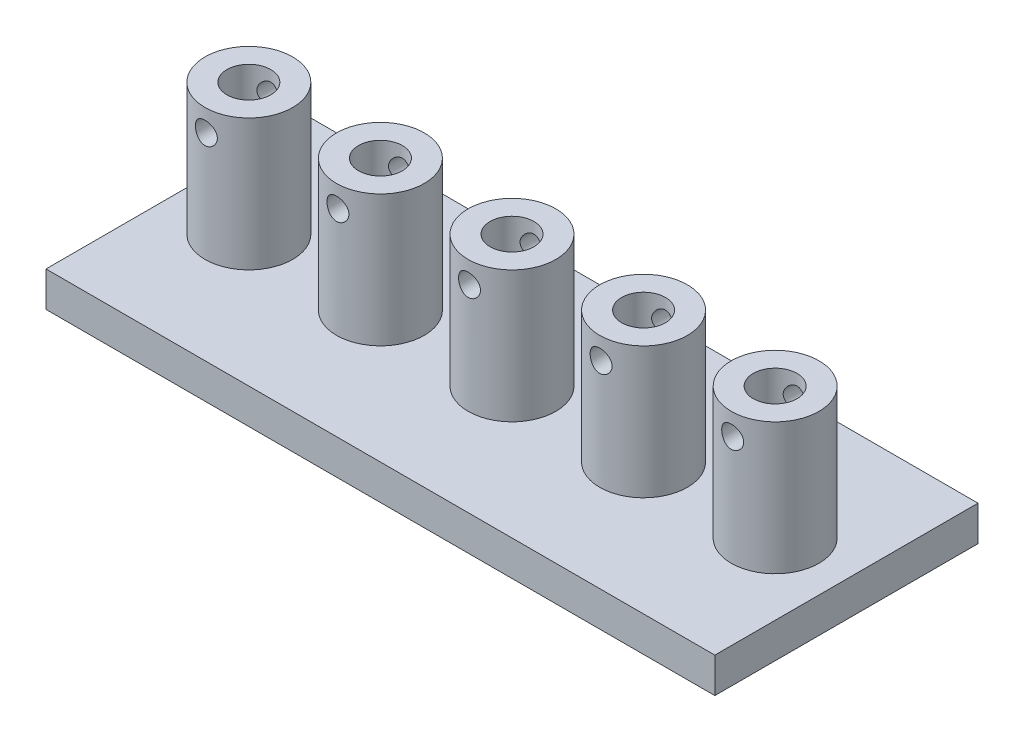
from build123d import *

# Parameters (mm, degrees)
SKETCH1_W               = 30.5
SKETCH1_H               = 12
BOSS_EXTRUDE1_DEPTH     = 1.6
SKETCH2_R               = 2
SKETCH2_R_2             = 1
BOSS_EXTRUDE2_DEPTH     = 6
CUT_EXTRUDE1_DEPTH      = 2
CUT_EXTRUDE1_DEPTH_BACK = 2
SKETCH3_R               = 0.5


with BuildPart() as part:
    # Sketch1 → Boss-Extrude1 (new body)
    with BuildSketch(Plane(origin=(0, 0, 0), x_dir=(1, 0, 0), z_dir=(0, 1, 0))):
        Rectangle(SKETCH1_W, SKETCH1_H)
    extrude(amount=BOSS_EXTRUDE1_DEPTH)

    # Sketch2 → Boss-Extrude2 (add)
    # profile 1 of 5: a face of its own
    with BuildSketch(Plane(origin=(0, 1.6, 0), x_dir=(1, 0, 0), z_dir=(0, 1, 0))):
        with Locations(Location((0, 0, 0), (0, 0, 270))):
            Circle(SKETCH2_R)
        with Locations(Location((0, 0, 0), (0, 0, 270))):
            Circle(SKETCH2_R_2, mode=Mode.SUBTRACT)
    # profile 2 of 5: a face of its own
    with BuildSketch(Plane(origin=(0, 1.6, 0), x_dir=(1, 0, 0), z_dir=(0, 1, 0))):
        with Locations(Location((6, 0, 0), (0, 0, 270))):
            Circle(SKETCH2_R)
        with Locations(Location((6, 0, 0), (0, 0, 270))):
            Circle(SKETCH2_R_2, mode=Mode.SUBTRACT)
    # profile 3 of 5: a face of its own
    with BuildSketch(Plane(origin=(0, 1.6, 0), x_dir=(1, 0, 0), z_dir=(0, 1, 0))):
        with Locations(Location((12, 0, 0), (0, 0, 270))):
            Circle(SKETCH2_R)
        with Locations(Location((12, 0, 0), (0, 0, 270))):
            Circle(SKETCH2_R_2, mode=Mode.SUBTRACT)
    # profile 4 of 5: a face of its own
    with BuildSketch(Plane(origin=(0, 1.6, 0), x_dir=(1, 0, 0), z_dir=(0, 1, 0))):
        with Locations(Location((-6, 0, 0), (0, 0, 270))):
            Circle(SKETCH2_R)
        with Locations(Location((-6, 0, 0), (0, 0, 270))):
            Circle(SKETCH2_R_2, mode=Mode.SUBTRACT)
    # profile 5 of 5: a face of its own
    with BuildSketch(Plane(origin=(0, 1.6, 0), x_dir=(1, 0, 0), z_dir=(0, 1, 0))):
        with Locations(Location((-12, 0, 0), (0, 0, 270))):
            Circle(SKETCH2_R)
        with Locations(Location((-12, 0, 0), (0, 0, 270))):
            Circle(SKETCH2_R_2, mode=Mode.SUBTRACT)
    extrude(amount=BOSS_EXTRUDE2_DEPTH)

    # Sketch3 → Cut-Extrude1 (cut, two sides: drawn at the far end of the back side and taken through both)
    with BuildSketch(Plane.XY.offset(-CUT_EXTRUDE1_DEPTH_BACK)):
        with Locations(Location((-12, 6.6, 0), (0, 0, 270.000000002))):
            Circle(SKETCH3_R)
        with Locations(Location((-6, 6.6, 0), (0, 0, 270.000000002))):
            Circle(SKETCH3_R)
        with Locations(Location((0, 6.6, 0), (0, 0, 270.000000002))):
            Circle(SKETCH3_R)
        with Locations(Location((6, 6.6, 0), (0, 0, 270.000000002))):
            Circle(SKETCH3_R)
        with Locations(Location((12, 6.6, 0), (0, 0, 270.000000002))):
            Circle(SKETCH3_R)
    extrude(amount=CUT_EXTRUDE1_DEPTH + CUT_EXTRUDE1_DEPTH_BACK, mode=Mode.SUBTRACT)


solid = part.part
